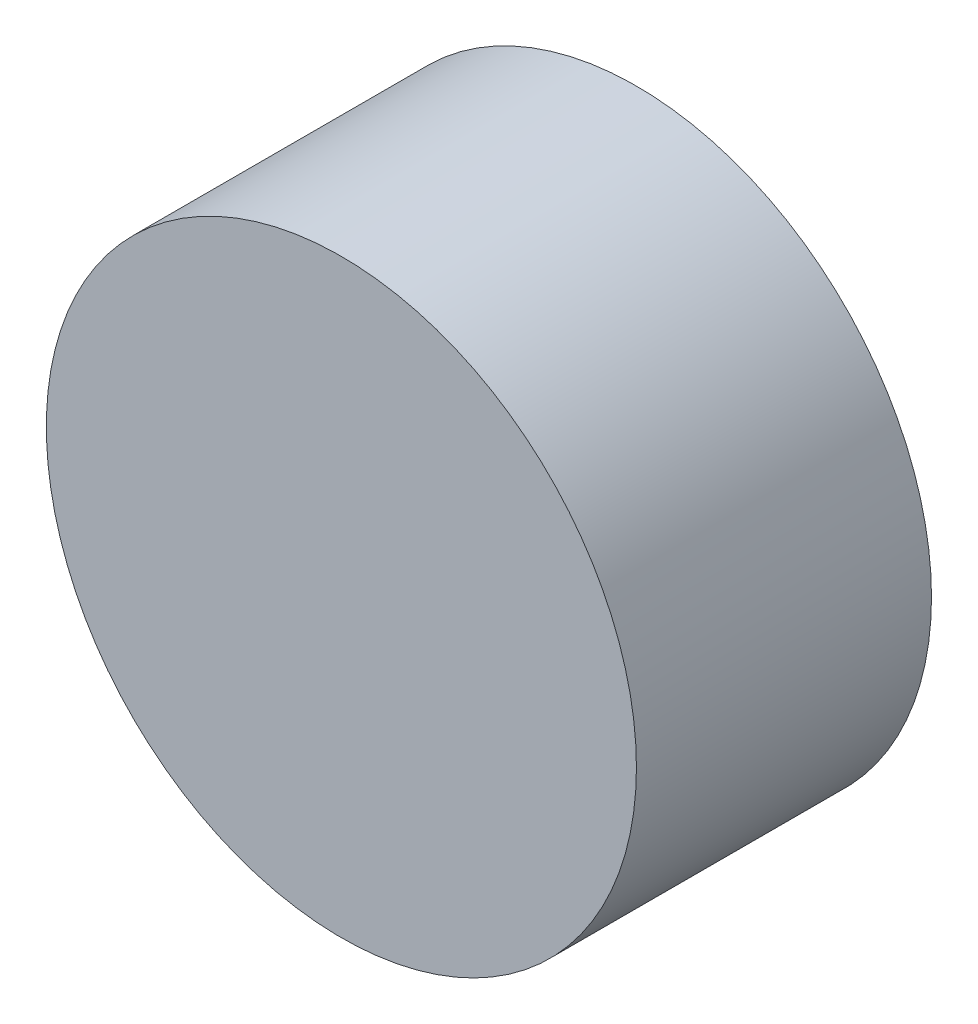
from build123d import *

# Parameters (mm, degrees)
SKETCH1_R           = 100
BOSS_EXTRUDE1_DEPTH = 100
SKETCH2_R           = 15
CUT_EXTRUDE1_DEPTH  = 10


with BuildPart() as part:
    # Sketch1 → Boss-Extrude1 (new body)
    with BuildSketch(Plane.XY):
        Circle(SKETCH1_R)
    extrude(amount=BOSS_EXTRUDE1_DEPTH)

    # Sketch2 → Cut-Extrude1 (cut)
    with BuildSketch(Plane(origin=(0, 0, 0), x_dir=(-1, 0, 0), z_dir=(0, 0, -1))):
        Circle(SKETCH2_R)
    extrude(amount=-CUT_EXTRUDE1_DEPTH, mode=Mode.SUBTRACT)


solid = part.part
